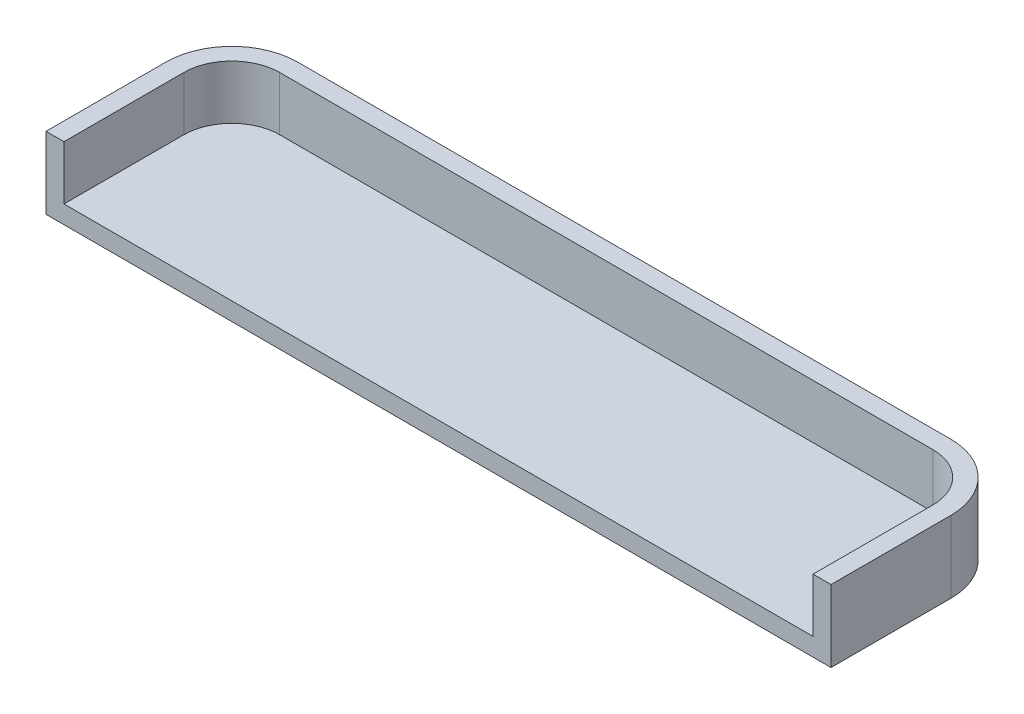
from build123d import *

# Parameters (mm, degrees)
EXTRUDE_1_DEPTH     = 12
CUT_EXTRUDE_1_DEPTH = 9


with BuildPart() as part:
    # 草图1 → 凸台-拉伸1 (new body)
    with BuildSketch(Plane(origin=(0, 0, 0), x_dir=(1, 0, 0), z_dir=(0, 1, 0))):
        with BuildLine():
            Line((0, 0), (109, 0))
            ThreePointArc((109, 0), (116.778174593, -3.221825407), (120, -11))
            Line((120, -11), (120, -31))
            Line((120, -31), (-11, -31))
            Line((-11, -31), (-11, -11))
            ThreePointArc((-11, -11), (-7.778174593, -3.221825407), (0, 0))
        make_face()
    extrude(amount=EXTRUDE_1_DEPTH)

    # 草图2 → 切除-拉伸1 (cut)
    with BuildSketch(Plane(origin=(0, 12, 0), x_dir=(1, 0, 0), z_dir=(0, 1, 0))):
        with BuildLine():
            Line((-8, -31), (-8, -11))
            ThreePointArc((-8, -11), (-5.656854249, -5.343145751), (0, -3))
            Line((0, -3), (109, -3))
            ThreePointArc((109, -3), (114.656854249, -5.343145751), (117, -11))
            Line((117, -11), (117, -31))
            Line((117, -31), (-8, -31))
        make_face()
    extrude(amount=-CUT_EXTRUDE_1_DEPTH, mode=Mode.SUBTRACT)


solid = part.part
